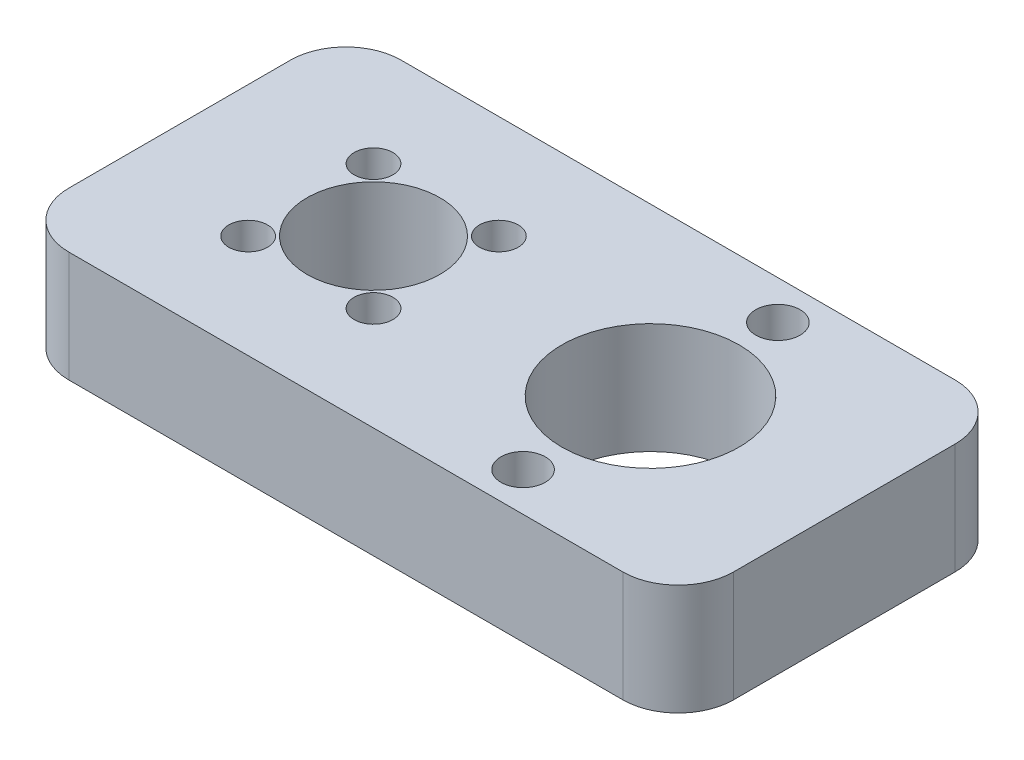
from build123d import *

# Parameters (mm, degrees)
SKETCH1_W           = 60
SKETCH1_H           = 30
SKETCH1_R           = 8
SKETCH1_R_2         = 6
SKETCH1_R_3         = 1.75
SKETCH1_R_4         = 2
BOSS_EXTRUDE1_DEPTH = 10
FILLET1_R           = 5


with BuildPart() as part:
    # Sketch1 → Boss-Extrude1 (new body)
    with BuildSketch(Plane(origin=(0, 0, 0), x_dir=(1, 0, 0), z_dir=(0, 1, 0))):
        Rectangle(SKETCH1_W, SKETCH1_H)
        with Locations(Location((12.5, 0, 0), (0, 0, 270))):
            Circle(SKETCH1_R, mode=Mode.SUBTRACT)
        with Locations(Location((-12.5, 0, 0), (0, 0, 270))):
            Circle(SKETCH1_R_2, mode=Mode.SUBTRACT)
        with Locations(Location((-18.156854249, 5.656854249, 0), (0, 0, 270))):
            Circle(SKETCH1_R_3, mode=Mode.SUBTRACT)
        with Locations(Location((-6.843145751, 5.656854249, 0), (0, 0, 270))):
            Circle(SKETCH1_R_3, mode=Mode.SUBTRACT)
        with Locations(Location((-6.843145751, -5.656854249, 0), (0, 0, 270))):
            Circle(SKETCH1_R_3, mode=Mode.SUBTRACT)
        with Locations(Location((-18.156854249, -5.656854249, 0), (0, 0, 270))):
            Circle(SKETCH1_R_3, mode=Mode.SUBTRACT)
        with Locations(Location((12.5, -11.5, 0), (0, 0, 270))):
            Circle(SKETCH1_R_4, mode=Mode.SUBTRACT)
        with Locations(Location((12.5, 11.5, 0), (0, 0, 270))):
            Circle(SKETCH1_R_4, mode=Mode.SUBTRACT)
    extrude(amount=BOSS_EXTRUDE1_DEPTH)

    # Fillet1
    fillet1_edges = [part.edges().sort_by_distance(p)[0] for p in [
        (30, 5, 15),
        (-30, 5, 15),
        (-30, 5, -15),
        (30, 5, -15),
    ]]
    fillet(fillet1_edges, radius=FILLET1_R)


solid = part.part
